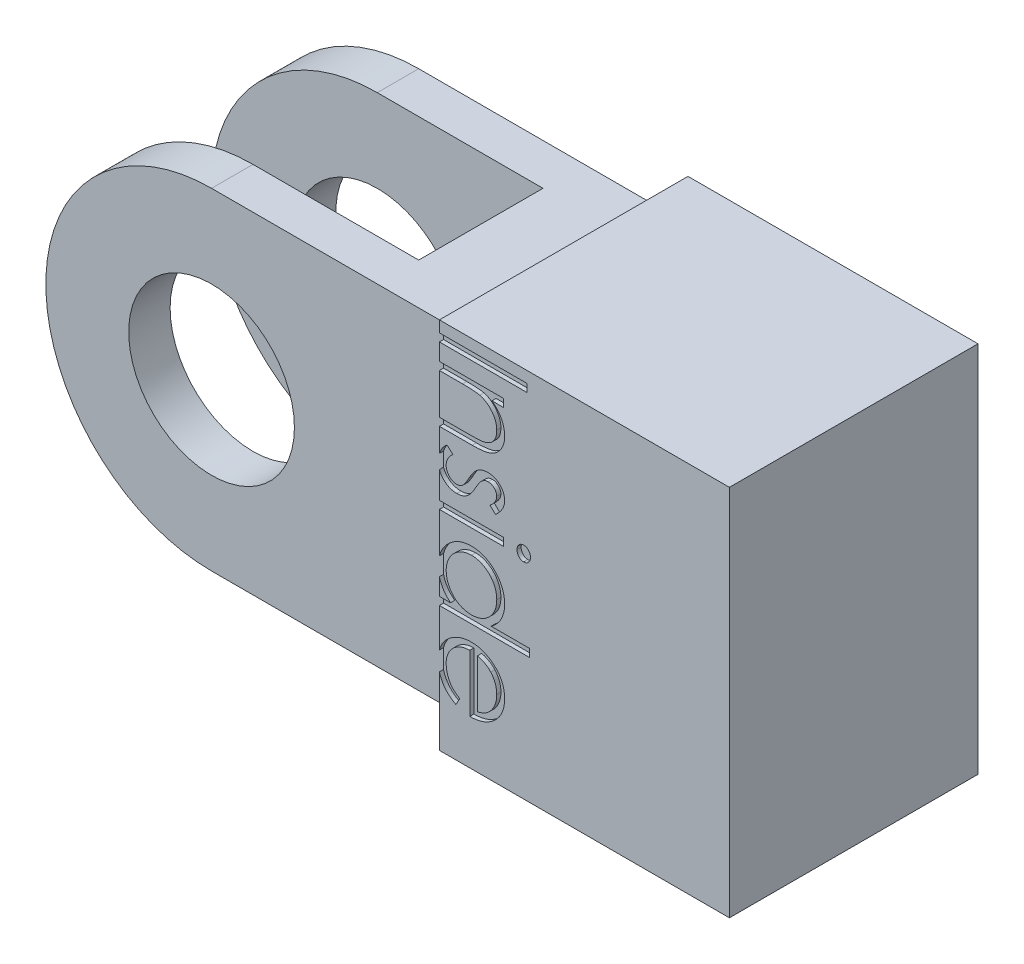
from build123d import *

# Parameters (mm, degrees)
BOSS_EXTRUDE1_DEPTH = 25
SKETCH2_R           = 20
CUT_EXTRUDE1_DEPTH  = 138.477270849
SKETCH3_W           = 80
SKETCH3_H           = 80
CUT_EXTRUDE2_DEPTH  = 15
SKETCH4_W           = 60
SKETCH4_H           = 90
BOSS_EXTRUDE2_DEPTH = 70
SKETCH5_W           = 21.166666667
SKETCH5_H           = 1.899572649
SKETCH5_W_2         = 15.467948718
SKETCH5_H_2         = 1.89957265
CUT_EXTRUDE3_DEPTH  = 1
SKETCH6_W           = 15.467948718
SKETCH6_H           = 1.89957265
CUT_EXTRUDE4_DEPTH  = 1


with BuildPart() as part:
    # Sketch1 → Boss-Extrude1 (new, symmetric)
    with BuildSketch(Plane.XY):
        with BuildLine():
            Line((-60, 0), (0, 0))
            Line((0, 0), (0, 80))
            Line((0, 80), (-60, 80))
            ThreePointArc((-60, 80), (-88.284271217, 68.284271278), (-100, 40.000000086))
            ThreePointArc((-100, 40.000000086), (-88.284271278, 11.715728783), (-60, 0))
        make_face()
    extrude(amount=BOSS_EXTRUDE1_DEPTH, both=True)

    # Sketch2 → Cut-Extrude1 (cut, through all)
    with BuildSketch(Plane.XY.offset(25)):
        with Locations((-60, 40)):
            Circle(SKETCH2_R)
    extrude(amount=-CUT_EXTRUDE1_DEPTH, mode=Mode.SUBTRACT)

    # Sketch3 → Cut-Extrude2 (cut, symmetric)
    with BuildSketch(Plane.XY):
        with Locations((-60, 40)):
            Rectangle(SKETCH3_W, SKETCH3_H)
    extrude(amount=CUT_EXTRUDE2_DEPTH, both=True, mode=Mode.SUBTRACT)

    # Sketch4 → Boss-Extrude2 (add)
    with BuildSketch(Plane(origin=(0, 0, 0), x_dir=(0, 0, -1), z_dir=(1, 0, 0))):
        with Locations((0, 40)):
            Rectangle(SKETCH4_W, SKETCH4_H)
    extrude(amount=BOSS_EXTRUDE2_DEPTH)

    # Sketch5 → Cut-Extrude3 (cut)
    # profile 1 of 7: a face of its own
    with BuildSketch(Plane.XY.offset(30)):
        with Locations((10.583333334, 81.336538461)):
            Rectangle(SKETCH5_W, SKETCH5_H)
    # profile 2 of 7: a face of its own
    with BuildSketch(Plane.XY.offset(30)):
        with BuildLine():
            Line((15.467948718, 76.316239316), (15.467948718, 74.416666667))
            Line((15.467948718, 74.416666667), (12.677951389, 74.416666667))
            add(Edge.make_bspline(
                [(12.677951389, 74.416666667), (12.931000237, 74.213843826), (13.422050354, 73.820259026), (14.067455733, 73.164791868), (14.599314951, 72.472073995), (15.023275991, 71.746347593), (15.342872254, 70.986627484), (15.573685266, 70.197544613), (15.712083991, 69.374374724), (15.730167764, 68.814580272), (15.739316239, 68.531383547)],
                knots=[0, 0, 0, 0, 1.12780773, 2.188550248, 3.19190651, 4.159438251, 5.104880172, 6.052711206, 7.014878035, 8, 8, 8, 8], degree=3))
            add(Edge.make_bspline(
                [(15.739316239, 68.531383547), (15.72874626, 68.245153637), (15.708058261, 67.68493266), (15.544892942, 66.869132505), (15.264578994, 66.106523799), (14.884479629, 65.398777141), (14.409256356, 64.762156372), (13.852647683, 64.208123481), (13.217320338, 63.74597719), (12.626105979, 63.436582915), (12.101877047, 63.232590322), (11.652853519, 63.104192901), (11.152607934, 62.995146052), (10.602639244, 62.900611913), (9.999098019, 62.836645352), (9.344457151, 62.786194416), (8.638929047, 62.750037531), (8.15096706, 62.748602997), (7.899338942, 62.747863248)],
                knots=[0, 0, 0, 0, 1.235764744, 2.418689688, 3.575570385, 4.733739044, 5.876600945, 6.994686206, 8.113221397, 9.257403329, 9.866223892, 10.540462211, 11.272173464, 12.077110251, 12.949508505, 13.892531187, 14.913238277, 16, 16, 16, 16], degree=3))
            Line((7.899338942, 62.747863248), (0, 62.747863248))
            Line((0, 62.747863248), (0, 64.647435897))
            Line((0, 64.647435897), (7.276041667, 64.647435897))
            add(Edge.make_bspline(
                [(7.276041667, 64.647435897), (7.486634548, 64.648604346), (7.889462889, 64.650839389), (8.46621841, 64.657888776), (8.989256289, 64.674881416), (9.457326083, 64.698759308), (9.869978332, 64.733708684), (10.228053482, 64.770131264), (10.531096905, 64.814671838), (10.713523832, 64.854361836), (10.795339209, 64.872162126)],
                knots=[0, 0, 0, 0, 1.430800155, 2.736877192, 3.918605307, 4.986035426, 5.920637409, 6.731861385, 7.431261377, 8, 8, 8, 8], degree=3))
            add(Edge.make_bspline(
                [(10.795339209, 64.872162126), (11.035497328, 64.936421293), (11.497727403, 65.060100307), (12.124710392, 65.365710586), (12.658099433, 65.751634441), (13.094596749, 66.222730959), (13.434296571, 66.774449655), (13.669996202, 67.405259518), (13.817414592, 68.109073202), (13.832092962, 68.604097326), (13.83974359, 68.862112714)],
                knots=[0, 0, 0, 0, 1.084156227, 2.086665306, 3.027808233, 3.945421172, 4.874247719, 5.839848303, 6.874090471, 8, 8, 8, 8], degree=3))
            add(Edge.make_bspline(
                [(13.83974359, 68.862112714), (13.836865967, 69.014922573), (13.831171225, 69.317329338), (13.773997745, 69.765752318), (13.680569417, 70.200751532), (13.55414807, 70.626518414), (13.382115263, 71.03402132), (13.182984952, 71.435168557), (12.9391429, 71.818480017), (12.665914546, 72.191205457), (12.361408734, 72.537560613), (12.044802516, 72.864452302), (11.702766682, 73.151661947), (11.347413018, 73.412369417), (10.971598324, 73.637144777), (10.579341125, 73.833426001), (10.170020613, 73.999946763), (9.885933963, 74.082695096), (9.743790064, 74.124098558)],
                knots=[0, 0, 0, 0, 1.02388931, 2.02625049, 3.024079426, 4.004119353, 4.998163158, 5.985366248, 7.002659681, 8.039138713, 9.080111048, 10.09169763, 11.086418407, 12.069932368, 13.043171485, 14.017654831, 15.008125612, 16, 16, 16, 16], degree=3))
            add(Edge.make_bspline(
                [(9.743790064, 74.124098558), (9.639437169, 74.147924051), (9.412266377, 74.199790905), (9.039464412, 74.255811088), (8.608208849, 74.306656901), (8.119002931, 74.349213746), (7.570133877, 74.375251265), (6.963945715, 74.403641188), (6.298021285, 74.413976938), (5.834400572, 74.415744984), (5.592715011, 74.416666667)],
                knots=[0, 0, 0, 0, 0.615963638, 1.340920617, 2.168419149, 3.115676021, 4.16674242, 5.331190069, 6.6087489, 8, 8, 8, 8], degree=3))
            Line((5.592715011, 74.416666667), (0, 74.416666667))
            Line((0, 74.416666667), (0, 76.316239316))
            Line((0, 76.316239316), (15.467948718, 76.316239316))
        make_face()
    # profile 3 of 7: a face of its own
    with BuildSketch(Plane.XY.offset(30)):
        with BuildLine():
            Line((13.538695246, 51.079059829), (12.211538462, 52.368055556))
            add(Edge.make_bspline(
                [(12.211538462, 52.368055556), (12.340460118, 52.479256068), (12.589005894, 52.693637566), (12.92087254, 53.033947594), (13.201893496, 53.372830526), (13.433125657, 53.708498999), (13.6151075, 54.041579423), (13.743639361, 54.37491567), (13.824331199, 54.707593019), (13.834667828, 54.9300788), (13.83974359, 55.039329594)],
                knots=[0, 0, 0, 0, 1.265880991, 2.440469525, 3.530740057, 4.536711111, 5.468008477, 6.34654737, 7.188078389, 8, 8, 8, 8], degree=3))
            add(Edge.make_bspline(
                [(13.83974359, 55.039329594), (13.83317976, 55.173182785), (13.820263073, 55.436586922), (13.69389018, 55.813479712), (13.495253203, 56.160914534), (13.219136492, 56.464238053), (12.898404106, 56.719798533), (12.54415122, 56.913499027), (12.159012115, 57.026926138), (11.892843714, 57.041668253), (11.757845887, 57.049145299)],
                knots=[0, 0, 0, 0, 1.000196853, 1.968245854, 2.94569445, 3.981000421, 5.021494845, 6.007172807, 6.989258906, 8, 8, 8, 8], degree=3))
            add(Edge.make_bspline(
                [(11.757845887, 57.049145299), (11.635611144, 57.04242753), (11.391486235, 57.029010928), (11.031362412, 56.924709582), (10.680255562, 56.758605241), (10.465184652, 56.603361685), (10.354366987, 56.523370726)],
                knots=[0, 0, 0, 0, 0.960159726, 1.917612774, 2.927026955, 4, 4, 4, 4], degree=3))
            add(Edge.make_bspline(
                [(10.354366987, 56.523370726), (10.295193549, 56.47521055), (10.169250342, 56.372707684), (9.994450848, 56.180341903), (9.801276283, 55.962491528), (9.608134459, 55.700509048), (9.404742597, 55.405681403), (9.19911065, 55.071615256), (8.97556389, 54.708912297), (8.833780875, 54.449243824), (8.760082799, 54.314269498)],
                knots=[0, 0, 0, 0, 0.66740084, 1.420478572, 2.27185888, 3.217733974, 4.268547843, 5.408967954, 6.65319498, 8, 8, 8, 8], degree=3))
            add(Edge.make_bspline(
                [(8.760082799, 54.314269498), (8.667887435, 54.149692151), (8.489796348, 53.831782908), (8.213361475, 53.380069506), (7.938609528, 52.970119306), (7.668478871, 52.59845884), (7.395411529, 52.272239329), (7.129874142, 51.981563225), (6.863843563, 51.733680731), (6.677981399, 51.594864126), (6.589142628, 51.528512286)],
                knots=[0, 0, 0, 0, 1.27191281, 2.456916733, 3.569705269, 4.599008579, 5.553216877, 6.436649441, 7.252746552, 8, 8, 8, 8], degree=3))
            add(Edge.make_bspline(
                [(6.589142628, 51.528512286), (6.409928675, 51.417829942), (6.053697995, 51.19782226), (5.463128562, 50.97579888), (4.841903508, 50.833889433), (4.414759213, 50.816518779), (4.197716346, 50.807692308)],
                knots=[0, 0, 0, 0, 0.995606783, 1.979007074, 2.973082153, 4, 4, 4, 4], degree=3))
            add(Edge.make_bspline(
                [(4.197716346, 50.807692308), (4.044893232, 50.812033789), (3.743738591, 50.820589152), (3.30030843, 50.880350286), (2.875900509, 50.982360717), (2.468031403, 51.123752557), (2.077496112, 51.305066026), (1.707236511, 51.532947658), (1.354107902, 51.797165686), (1.020095261, 52.096171214), (0.717054764, 52.428263376), (0.453413375, 52.785364022), (0.230751892, 53.162095274), (0.047958593, 53.558549027), (-0.097662435, 53.975567911), (-0.198413109, 54.413496728), (-0.25872946, 54.870867106), (-0.267101569, 55.18189548), (-0.271367521, 55.340377938)],
                knots=[0, 0, 0, 0, 1.032633728, 2.034917567, 3.017159222, 3.977707287, 4.947659047, 5.920662675, 6.910168127, 7.92466491, 8.94557085, 9.942744688, 10.919024275, 11.897637117, 12.88838639, 13.898512555, 14.929200919, 16, 16, 16, 16], degree=3))
            add(Edge.make_bspline(
                [(-0.271367521, 55.340377938), (-0.265364048, 55.554265142), (-0.253440519, 55.979067605), (-0.141522911, 56.607353049), (0.032620662, 57.221311923), (0.272807502, 57.816298095), (0.576099908, 58.379005546), (0.939334384, 58.893844947), (1.350511987, 59.362604744), (1.665671019, 59.629415257), (1.823250534, 59.762820513)],
                knots=[0, 0, 0, 0, 1.013940152, 2.01379169, 3.017749504, 4.037548394, 5.051665909, 6.043208538, 7.021604269, 8, 8, 8, 8], degree=3))
            Line((1.823250534, 59.762820513), (3.256410256, 58.503505609))
            add(Edge.make_bspline(
                [(3.256410256, 58.503505609), (3.127264776, 58.383929588), (2.876896734, 58.15211339), (2.543525721, 57.781386984), (2.264118034, 57.404140129), (2.030417383, 57.024139882), (1.850347087, 56.635761216), (1.723839401, 56.241180597), (1.642534048, 55.841200604), (1.632989197, 55.572552449), (1.628205128, 55.437900641)],
                knots=[0, 0, 0, 0, 1.179806542, 2.287233372, 3.337373186, 4.324005949, 5.273901747, 6.200048787, 7.097828587, 8, 8, 8, 8], degree=3))
            add(Edge.make_bspline(
                [(1.628205128, 55.437900641), (1.636495355, 55.254549375), (1.652693067, 54.896311756), (1.799753576, 54.383209026), (2.030348999, 53.909446856), (2.357432649, 53.498067576), (2.738163969, 53.147897364), (3.167025548, 52.894331738), (3.631431024, 52.735423439), (3.953359711, 52.716760494), (4.117154113, 52.707264957)],
                knots=[0, 0, 0, 0, 1.072336372, 2.095165389, 3.102688358, 4.141489647, 5.156069229, 6.117746104, 7.042326257, 8, 8, 8, 8], degree=3))
            add(Edge.make_bspline(
                [(4.117154113, 52.707264957), (4.252074188, 52.713834452), (4.518455815, 52.726805039), (4.903993592, 52.828666731), (5.269688765, 52.989611124), (5.48371187, 53.148086854), (5.592715011, 53.228799412)],
                knots=[0, 0, 0, 0, 1.013901739, 2.00181326, 2.98231254, 4, 4, 4, 4], degree=3))
            add(Edge.make_bspline(
                [(5.592715011, 53.228799412), (5.647357439, 53.277315798), (5.766388383, 53.383002007), (5.938292431, 53.576859895), (6.123579983, 53.808978776), (6.319109116, 54.081969285), (6.522300681, 54.396381745), (6.732088669, 54.753490478), (6.958437296, 55.148403343), (7.108537117, 55.427625732), (7.186999199, 55.573584402)],
                knots=[0, 0, 0, 0, 0.615000592, 1.339693406, 2.178160186, 3.116406724, 4.166410947, 5.330106347, 6.604359322, 8, 8, 8, 8], degree=3))
            add(Edge.make_bspline(
                [(7.186999199, 55.573584402), (7.274926328, 55.731104558), (7.445445093, 56.036586412), (7.711032817, 56.469277172), (7.981163478, 56.85963498), (8.240683982, 57.217052741), (8.50327731, 57.532502632), (8.769234973, 57.804741939), (9.02783108, 58.044489006), (9.211057588, 58.177218591), (9.298577724, 58.240618323)],
                knots=[0, 0, 0, 0, 1.262093308, 2.447601706, 3.550203992, 4.582594899, 5.537233252, 6.418365656, 7.244515135, 8, 8, 8, 8], degree=3))
            add(Edge.make_bspline(
                [(9.298577724, 58.240618323), (9.474839301, 58.350265282), (9.82742405, 58.569597519), (10.415920743, 58.78256558), (11.035469423, 58.928954421), (11.46295659, 58.942031733), (11.681523771, 58.948717949)],
                knots=[0, 0, 0, 0, 0.985009483, 1.970363186, 2.962279964, 4, 4, 4, 4], degree=3))
            add(Edge.make_bspline(
                [(11.681523771, 58.948717949), (11.824400852, 58.945486871), (12.104031542, 58.939163195), (12.514904232, 58.888708135), (12.905250143, 58.796810421), (13.28103036, 58.681660563), (13.634606909, 58.521182862), (13.972746631, 58.33058658), (14.289127804, 58.100586031), (14.585331363, 57.842062316), (14.857179179, 57.56101763), (15.090280605, 57.253207239), (15.29073508, 56.929647233), (15.458584311, 56.588452278), (15.585610025, 56.226696688), (15.673038029, 55.846814869), (15.731430319, 55.449601454), (15.736649743, 55.178056384), (15.739316239, 55.039329594)],
                knots=[0, 0, 0, 0, 1.087761869, 2.12890409, 3.144425528, 4.138218063, 5.116152125, 6.094559764, 7.089109474, 8.088306095, 9.085414286, 10.060442677, 11.0220762, 11.979848209, 12.949875201, 13.933947973, 14.944496518, 16, 16, 16, 16], degree=3))
            add(Edge.make_bspline(
                [(15.739316239, 55.039329594), (15.732653242, 54.874874283), (15.719202256, 54.54287865), (15.611881111, 54.044955127), (15.437106149, 53.548329127), (15.190050988, 53.05249165), (14.879313187, 52.555330212), (14.496837303, 52.059073277), (14.053419618, 51.555658208), (13.714103643, 51.241475604), (13.538695246, 51.079059829)],
                knots=[0, 0, 0, 0, 0.845753203, 1.707371858, 2.609134499, 3.549244224, 4.552329203, 5.621587647, 6.770486714, 8, 8, 8, 8], degree=3))
        make_face()
    # profile 4 of 7: a face of its own
    with BuildSketch(Plane.XY.offset(30)):
        with BuildLine():
            add(Edge.make_bspline(
                [(21.980769231, 46.33860844), (21.975277543, 46.220752069), (21.964523764, 45.989966659), (21.873169824, 45.655899246), (21.71595729, 45.352013667), (21.511891589, 45.078452093), (21.262033491, 44.851682121), (20.978139463, 44.689075983), (20.669076615, 44.58526872), (20.453728209, 44.572659356), (20.344083868, 44.566239316)],
                knots=[0, 0, 0, 0, 1.054986045, 2.065865298, 3.074122704, 4.105114675, 5.109626121, 6.074217918, 7.019490725, 8, 8, 8, 8], degree=3))
            add(Edge.make_bspline(
                [(20.344083868, 44.566239316), (20.237285551, 44.572802977), (20.026157919, 44.585778558), (19.722453831, 44.688999245), (19.442512965, 44.853045382), (19.193143358, 45.078301156), (18.989195545, 45.352053531), (18.831951865, 45.6558887), (18.740606155, 45.989969433), (18.729851242, 46.220753007), (18.724358974, 46.33860844)],
                knots=[0, 0, 0, 0, 0.961106377, 1.899993565, 2.859409042, 3.870007927, 4.90724781, 5.921615355, 6.938620636, 8, 8, 8, 8], degree=3))
            add(Edge.make_bspline(
                [(18.724358974, 46.33860844), (18.729674849, 46.455110277), (18.740021504, 46.681865881), (18.833044737, 47.009790776), (18.988853606, 47.308786728), (19.195965722, 47.577874547), (19.440854822, 47.807596338), (19.722665289, 47.971037191), (20.026104082, 48.074533858), (20.237267466, 48.087472247), (20.344083868, 48.094017094)],
                knots=[0, 0, 0, 0, 1.055304112, 2.054011575, 3.063363921, 4.096942562, 5.122536081, 6.088009498, 7.032825006, 8, 8, 8, 8], degree=3))
            add(Edge.make_bspline(
                [(20.344083868, 48.094017094), (20.453746981, 48.087616567), (20.669132256, 48.075045528), (20.977924388, 47.970956862), (21.26370578, 47.808976415), (21.509071271, 47.577726115), (21.716298478, 47.308825586), (21.87207725, 47.009780657), (21.965108351, 46.681868567), (21.975453916, 46.455111189), (21.980769231, 46.33860844)],
                knots=[0, 0, 0, 0, 0.986662878, 1.937868148, 2.908513651, 3.927890639, 4.955204348, 5.958438607, 6.951092507, 8, 8, 8, 8], degree=3))
        make_face()
    # profile 5 of 7: a face of its own
    with BuildSketch(Plane.XY.offset(30)):
        with Locations((7.733974359, 46.330128205)):
            Rectangle(SKETCH5_W_2, SKETCH5_H_2)
    # profile 6 of 7: a face of its own
    with BuildSketch(Plane.XY.offset(30)):
        with BuildLine():
            Line((21.709401709, 25.299145299), (0, 25.299145299))
            Line((0, 25.299145299), (0, 27.198717949))
            Line((0, 27.198717949), (2.675514156, 27.198717949))
            add(Edge.make_bspline(
                [(2.675514156, 27.198717949), (2.433304588, 27.412872511), (1.96062957, 27.830797833), (1.344959191, 28.528692985), (0.831872211, 29.26538441), (0.42131859, 30.043363262), (0.110577536, 30.860301849), (-0.107944581, 31.71387047), (-0.250196512, 32.602931526), (-0.264247206, 33.209240509), (-0.271367521, 33.516493056)],
                knots=[0, 0, 0, 0, 1.074295371, 2.096500925, 3.086030275, 4.053105238, 5.014108356, 5.985331429, 6.979048527, 8, 8, 8, 8], degree=3))
            add(Edge.make_bspline(
                [(-0.271367521, 33.516493056), (-0.26395212, 33.789652376), (-0.24932862, 34.32833465), (-0.135843657, 35.120737919), (0.046309517, 35.883335221), (0.299950649, 36.616612575), (0.634660847, 37.315601426), (1.039706419, 37.98424039), (1.517326697, 38.624089951), (2.065474638, 39.222981511), (2.660211556, 39.77517437), (3.296399546, 40.258287349), (3.965300582, 40.667741329), (4.666726662, 41.004239167), (5.400165046, 41.264638839), (6.16511258, 41.445806552), (6.960296432, 41.559169221), (7.501799667, 41.573785312), (7.776375534, 41.581196581)],
                knots=[0, 0, 0, 0, 1.034036272, 2.039165313, 3.024406509, 3.999331371, 4.971254918, 5.953351348, 6.95522652, 7.989525907, 9.023492927, 10.024309745, 11.009187477, 11.988246066, 12.964946762, 13.950187958, 14.960617622, 16, 16, 16, 16], degree=3))
            add(Edge.make_bspline(
                [(7.776375534, 41.581196581), (8.045276221, 41.573620933), (8.576878373, 41.558644286), (9.358690126, 41.447019569), (10.11179028, 41.259454322), (10.833389072, 40.995728729), (11.52639262, 40.659051953), (12.185378851, 40.24255629), (12.8204284, 39.759617402), (13.411176353, 39.201522998), (13.954877102, 38.597256167), (14.433658091, 37.95382671), (14.837665161, 37.27925755), (15.166083633, 36.572196078), (15.427064943, 35.837648915), (15.608994045, 35.070036101), (15.715939234, 34.272848426), (15.731449031, 33.731649709), (15.739316239, 33.45713141)],
                knots=[0, 0, 0, 0, 1.02050356, 2.017480486, 2.990790918, 3.96161403, 4.928589988, 5.909588639, 6.91611943, 7.952353252, 8.989586576, 9.99823133, 10.991940466, 11.968822692, 12.952985106, 13.945868367, 14.958059758, 16, 16, 16, 16], degree=3))
            add(Edge.make_bspline(
                [(15.739316239, 33.45713141), (15.729883929, 33.141329964), (15.711369352, 32.521446822), (15.555039459, 31.613779775), (15.295715411, 30.754329626), (14.937078659, 29.94006638), (14.474288059, 29.175830144), (13.910447675, 28.458482376), (13.238929586, 27.793390841), (12.733145644, 27.399964432), (12.474425748, 27.198717949)],
                knots=[0, 0, 0, 0, 1.030970925, 2.023681352, 2.997808474, 3.956843046, 4.921958419, 5.908293655, 6.930045022, 8, 8, 8, 8], degree=3))
            Line((12.474425748, 27.198717949), (21.709401709, 27.198717949))
            Line((21.709401709, 27.198717949), (21.709401709, 25.299145299))
        make_face()
        with BuildLine():
            add(Edge.make_bspline(
                [(13.83974359, 33.431690705), (13.829864077, 33.709363297), (13.810363491, 34.257444826), (13.658122245, 35.06204185), (13.404825952, 35.831993961), (13.058385102, 36.563395581), (12.622863338, 37.244896716), (12.095688317, 37.853385142), (11.493624382, 38.39614079), (10.811609692, 38.844881801), (10.088794938, 39.223215115), (9.327472416, 39.482657837), (8.548763432, 39.655299446), (8.020393214, 39.672826256), (7.755174947, 39.681623932)],
                knots=[0, 0, 0, 0, 1.031093775, 2.03521511, 3.029845951, 4.035119871, 5.034286494, 6.024708811, 7.017619509, 8.03559408, 9.050082311, 10.039808432, 11.016071318, 12, 12, 12, 12], degree=3))
            add(Edge.make_bspline(
                [(7.755174947, 39.681623932), (7.49159388, 39.670241802), (6.965464896, 39.647522158), (6.18444226, 39.487208546), (5.426184619, 39.209439404), (4.693357298, 38.839741587), (4.009942689, 38.380934968), (3.396105462, 37.842683837), (2.866816245, 37.226436072), (2.423801006, 36.543456705), (2.067194801, 35.815110643), (1.815736301, 35.048806907), (1.656953797, 34.258009691), (1.637820252, 33.719344839), (1.628205128, 33.448651175)],
                knots=[0, 0, 0, 0, 0.979154363, 1.954470772, 2.947816011, 3.971783346, 4.997163654, 5.998045606, 6.995988793, 8.00538986, 9.015323546, 10.000094788, 10.994993517, 12, 12, 12, 12], degree=3))
            add(Edge.make_bspline(
                [(1.628205128, 33.448651175), (1.638093615, 33.173775382), (1.657710814, 32.628465111), (1.812498121, 31.821974348), (2.06264501, 31.038112608), (2.414044397, 30.288540084), (2.84755241, 29.590775167), (3.35729958, 28.965317657), (3.945165004, 28.43124757), (4.596429063, 27.983528705), (5.307054088, 27.629853243), (6.066875716, 27.380401363), (6.869922844, 27.227191304), (7.419517151, 27.208340301), (7.700053419, 27.198717949)],
                knots=[0, 0, 0, 0, 1.017484689, 2.018529338, 3.030031036, 4.058138743, 5.076350332, 6.065651025, 7.036469986, 8.00785331, 8.984076697, 9.96571663, 10.961615403, 12, 12, 12, 12], degree=3))
            add(Edge.make_bspline(
                [(7.700053419, 27.198717949), (7.913763073, 27.204521677), (8.334411303, 27.21594525), (8.952040802, 27.303214526), (9.543092831, 27.442041974), (10.108214318, 27.637641827), (10.644186748, 27.894677854), (11.155211402, 28.204360128), (11.636528152, 28.573040692), (12.087527457, 28.989499657), (12.496826346, 29.450491698), (12.857578953, 29.940696988), (13.162874925, 30.458882175), (13.407191557, 31.004683522), (13.606230192, 31.573897228), (13.73769177, 32.171979101), (13.828248508, 32.792901568), (13.835871552, 33.216519065), (13.83974359, 33.431690705)],
                knots=[0, 0, 0, 0, 1.050062701, 2.066855696, 3.059271411, 4.030305351, 4.999747758, 5.975466543, 6.961907836, 7.974539719, 8.98812422, 9.98710676, 10.961662635, 11.93785114, 12.922015094, 13.919620009, 14.94329489, 16, 16, 16, 16], degree=3))
        make_face(mode=Mode.SUBTRACT)
    # profile 7 of 7: a face of its own
    with BuildSketch(Plane.XY.offset(30)):
        with BuildLine():
            Line((4.884615385, 8.262353098), (3.998430823, 6.574786325))
            add(Edge.make_bspline(
                [(3.998430823, 6.574786325), (3.759912093, 6.709284127), (3.2958491, 6.970963589), (2.657968638, 7.420644521), (2.086099068, 7.892606499), (1.589093236, 8.40312727), (1.158183591, 8.945919037), (0.7836561, 9.521779143), (0.460983615, 10.128783319), (0.190575003, 10.769071315), (-0.017586153, 11.448175007), (-0.164550326, 12.167983409), (-0.255410521, 12.929807767), (-0.265963739, 13.451997026), (-0.271367521, 13.719384348)],
                knots=[0, 0, 0, 0, 1.120373846, 2.179803828, 3.190307243, 4.151866639, 5.090753574, 6.023181945, 6.960194942, 7.901556876, 8.864247182, 9.862852693, 10.905672442, 12, 12, 12, 12], degree=3))
            add(Edge.make_bspline(
                [(-0.271367521, 13.719384348), (-0.264429841, 14.016576306), (-0.250896438, 14.596311719), (-0.13422297, 15.44019497), (0.056109893, 16.234727578), (0.321996644, 16.979865257), (0.669295566, 17.673781839), (1.092382588, 18.317861595), (1.589091996, 18.91547248), (2.163696946, 19.447854781), (2.7786986, 19.926923088), (3.419233956, 20.350416879), (4.08562876, 20.701997583), (4.767519318, 20.99766046), (5.471181, 21.221673554), (6.192757248, 21.385651544), (6.935823551, 21.478374193), (7.438336957, 21.492753635), (7.691573184, 21.5)],
                knots=[0, 0, 0, 0, 1.145226127, 2.234004399, 3.276654467, 4.290038057, 5.276870678, 6.260645262, 7.254731018, 8.264593254, 9.273837991, 10.257612574, 11.220387342, 12.174754112, 13.118989047, 14.062768009, 15.023752772, 16, 16, 16, 16], degree=3))
            add(Edge.make_bspline(
                [(7.691573184, 21.5), (7.929213349, 21.493594717), (8.400184773, 21.480900291), (9.097266876, 21.400885529), (9.774772279, 21.259079185), (10.433263941, 21.064489036), (11.071639322, 20.813202928), (11.690286945, 20.505789031), (12.288548505, 20.14176846), (12.665938885, 19.860719433), (12.856036325, 19.719150641)],
                knots=[0, 0, 0, 0, 1.024358464, 2.0301432, 3.019427413, 4.004406732, 4.986367066, 5.972626655, 6.978780325, 8, 8, 8, 8], degree=3))
            add(Edge.make_bspline(
                [(12.856036325, 19.719150641), (13.085052825, 19.527394655), (13.535831163, 19.149957025), (14.128124848, 18.5115924), (14.624294345, 17.820348355), (15.035575597, 17.084887569), (15.348078129, 16.296662226), (15.580957317, 15.466267942), (15.711452907, 14.584249397), (15.729885044, 13.981270204), (15.739316239, 13.672743056)],
                knots=[0, 0, 0, 0, 1.030682036, 2.02871468, 2.997146059, 3.962720338, 4.930598197, 5.918074684, 6.934738563, 8, 8, 8, 8], degree=3))
            add(Edge.make_bspline(
                [(15.739316239, 13.672743056), (15.731127467, 13.355559919), (15.715062964, 12.733318908), (15.566132281, 11.825981795), (15.329957308, 10.967457461), (14.996408194, 10.158089459), (14.566062333, 9.39779573), (14.033014054, 8.691518192), (13.413628478, 8.027178092), (12.937298593, 7.640683353), (12.694911859, 7.444010417)],
                knots=[0, 0, 0, 0, 1.056321875, 2.072262726, 3.055038591, 4.01806755, 4.982017516, 5.957941055, 6.960871419, 8, 8, 8, 8], degree=3))
            add(Edge.make_bspline(
                [(12.694911859, 7.444010417), (12.512252105, 7.310195123), (12.148148435, 7.043455251), (11.554446675, 6.709341836), (10.933292128, 6.419313781), (10.274644141, 6.187490635), (9.58630668, 5.999775557), (8.86335891, 5.863965272), (8.106016112, 5.784320436), (7.58999361, 5.76866498), (7.326923077, 5.760683761)],
                knots=[0, 0, 0, 0, 0.94817472, 1.890038105, 2.849395472, 3.817997239, 4.812318967, 5.836947057, 6.897266129, 8, 8, 8, 8], degree=3))
            Line((7.326923077, 5.760683761), (7.326923077, 19.60042735))
            add(Edge.make_bspline(
                [(7.326923077, 19.60042735), (7.12311963, 19.591107555), (6.72234837, 19.572780554), (6.135847425, 19.487543221), (5.577420956, 19.352535702), (5.049448283, 19.164871332), (4.550195895, 18.929559574), (4.076223003, 18.650368862), (3.634727785, 18.315251482), (3.21998902, 17.942085605), (2.850785244, 17.526514373), (2.520074573, 17.089473468), (2.244426284, 16.625226634), (2.017313301, 16.138453885), (1.842511933, 15.626630786), (1.722137772, 15.090477091), (1.641721774, 14.531660674), (1.632764993, 14.15075079), (1.628205128, 13.956830929)],
                knots=[0, 0, 0, 0, 1.094405546, 2.152104367, 3.174987145, 4.173015398, 5.153654967, 6.133208507, 7.119289451, 8.123438607, 9.122504012, 10.097966803, 11.060604936, 12.014205423, 12.976096155, 13.956823727, 14.959826266, 16, 16, 16, 16], degree=3))
            add(Edge.make_bspline(
                [(1.628205128, 13.956830929), (1.631856849, 13.767226303), (1.639102565, 13.391014353), (1.710604541, 12.829453468), (1.824327601, 12.276676125), (1.980635028, 11.736652632), (2.173186569, 11.221124492), (2.403993974, 10.742327162), (2.65639149, 10.298647626), (2.949604461, 9.886364732), (3.304784691, 9.486465978), (3.753095326, 9.09476257), (4.277864897, 8.669085908), (4.674436343, 8.403245794), (4.884615385, 8.262353098)],
                knots=[0, 0, 0, 0, 0.990963276, 1.966261236, 2.95471375, 3.93937425, 4.902926125, 5.828461241, 6.715766441, 7.568835615, 8.469155523, 9.505141836, 10.677749234, 12, 12, 12, 12], degree=3))
        make_face()
        with BuildLine():
            add(Edge.make_bspline(
                [(9.226495726, 7.66025641), (9.478517807, 7.729665046), (9.963579185, 7.863254327), (10.633687221, 8.14418895), (11.232691923, 8.453385833), (11.750702863, 8.826590029), (12.207561915, 9.253089774), (12.610846408, 9.740518543), (12.969900332, 10.287729063), (13.273283236, 10.890952231), (13.531433206, 11.529856204), (13.704552897, 12.198754243), (13.82314239, 12.881276746), (13.834186206, 13.342917216), (13.83974359, 13.575220353)],
                knots=[0, 0, 0, 0, 1.154756201, 2.222533969, 3.206705588, 4.129403772, 5.035894089, 5.963342549, 6.920206228, 7.923656548, 8.944970878, 9.96070521, 10.973801891, 12, 12, 12, 12], degree=3))
            add(Edge.make_bspline(
                [(13.83974359, 13.575220353), (13.83602882, 13.764804565), (13.828685502, 14.139572695), (13.759544111, 14.691802612), (13.643768004, 15.223098342), (13.48958432, 15.736385237), (13.277150445, 16.222728983), (13.033114772, 16.694785926), (12.733293106, 17.140895718), (12.504970936, 17.419952393), (12.389623397, 17.560930823)],
                knots=[0, 0, 0, 0, 1.048700258, 2.073059931, 3.073189922, 4.055269162, 5.032885305, 6.005420607, 6.992345662, 8, 8, 8, 8], degree=3))
            add(Edge.make_bspline(
                [(12.389623397, 17.560930823), (12.298338727, 17.661885433), (12.113600801, 17.866192959), (11.795319409, 18.139185636), (11.452107581, 18.40056659), (11.070834684, 18.638441538), (10.655842354, 18.856625037), (10.210630941, 19.060792518), (9.731822011, 19.244557962), (9.398160116, 19.347948723), (9.226495726, 19.401141827)],
                knots=[0, 0, 0, 0, 0.879870761, 1.780643979, 2.707998968, 3.669668524, 4.684282772, 5.740141944, 6.837334558, 8, 8, 8, 8], degree=3))
            Line((9.226495726, 19.401141827), (9.226495726, 7.66025641))
        make_face(mode=Mode.SUBTRACT)
    extrude(amount=-CUT_EXTRUDE3_DEPTH, mode=Mode.SUBTRACT)

    # Sketch6 → Cut-Extrude4 (cut)
    # profile 1 of 7: a face of its own
    with BuildSketch(Plane(origin=(0, 0, -30), x_dir=(-1, 0, 0), z_dir=(0, 0, -1))):
        with BuildLine():
            add(Edge.make_bspline(
                [(-21.709401709, 7.618589744), (-21.699641785, 8.010567212), (-21.680472487, 8.780443301), (-21.528890206, 9.910873458), (-21.279401633, 10.993311021), (-20.927070495, 12.02837827), (-20.470317448, 13.012138589), (-19.915493303, 13.947370376), (-19.259226285, 14.831270836), (-18.511153048, 15.657755726), (-17.691890767, 16.411701417), (-16.814854958, 17.073292675), (-15.891072274, 17.631407336), (-14.920494534, 18.088284974), (-13.905387766, 18.4469642), (-12.840062819, 18.694409584), (-11.731497244, 18.852487914), (-10.97538192, 18.870967437), (-10.591813568, 18.88034188)],
                knots=[0, 0, 0, 0, 1.065064174, 2.09187391, 3.093564831, 4.079973196, 5.057907931, 6.036227367, 7.030399151, 8.044883615, 9.061699972, 10.052012555, 11.025713132, 11.989727027, 12.962874294, 13.945865945, 14.957962116, 16, 16, 16, 16], degree=3))
            add(Edge.make_bspline(
                [(-10.591813568, 18.88034188), (-10.21107289, 18.870964282), (-9.460588905, 18.852479949), (-8.359026446, 18.694281319), (-7.300248504, 18.445860086), (-6.28661496, 18.092725911), (-5.318008501, 17.635497685), (-4.393526484, 17.076561396), (-3.514148109, 16.416225763), (-2.689241779, 15.665481711), (-1.934643478, 14.844658725), (-1.269058384, 13.970993617), (-0.710700769, 13.047235565), (-0.248722506, 12.082957434), (0.102481898, 11.070587405), (0.3581703, 10.01749251), (0.514679357, 8.917935143), (0.533280527, 8.168906986), (0.542735043, 7.788194444)],
                knots=[0, 0, 0, 0, 1.043748596, 2.057349401, 3.045489418, 4.02252776, 4.995289225, 5.97782527, 6.980224157, 8.006516136, 9.032559198, 10.034193337, 11.013412982, 11.987833483, 12.961212594, 13.946489799, 14.956251404, 16, 16, 16, 16], degree=3))
            add(Edge.make_bspline(
                [(0.542735043, 7.788194444), (0.533364941, 7.404628325), (0.514893977, 6.6485174), (0.356558815, 5.538555329), (0.108961406, 4.472494687), (-0.244881375, 3.453384087), (-0.70218558, 2.480655227), (-1.259802539, 1.55240568), (-1.92145525, 0.672361313), (-2.672367391, -0.15218163), (-3.489833444, -0.906617257), (-4.365735844, -1.564352529), (-5.282890272, -2.122094881), (-6.243841966, -2.577863606), (-7.243945452, -2.938691527), (-8.289871959, -3.184858761), (-9.375658494, -3.344128566), (-10.114936975, -3.362482161), (-10.490050748, -3.371794872)],
                knots=[0, 0, 0, 0, 1.053102029, 2.075944431, 3.073151272, 4.055350789, 5.033113405, 6.020478099, 7.024410459, 8.052272461, 9.079885166, 10.07527673, 11.055994387, 12.023226415, 12.992069828, 13.970394897, 14.97016774, 16, 16, 16, 16], degree=3))
            add(Edge.make_bspline(
                [(-10.490050748, -3.371794872), (-10.741829271, -3.3685616), (-11.242210018, -3.362135845), (-11.985260409, -3.284776562), (-12.716361054, -3.172522465), (-13.433432977, -3.011644232), (-14.134720837, -2.801237484), (-14.825061165, -2.552970461), (-15.49745797, -2.249743777), (-16.155096577, -1.90696081), (-16.787725341, -1.524377495), (-17.385711391, -1.101795582), (-17.954072658, -0.654057877), (-18.478080729, -0.163212592), (-18.972979508, 0.354563053), (-19.431163558, 0.907668483), (-19.856764452, 1.492728722), (-20.240306515, 2.112261209), (-20.58719271, 2.7510003), (-20.884867713, 3.409445576), (-21.1403558, 4.078654365), (-21.347431266, 4.761761045), (-21.510910722, 5.456951619), (-21.622231385, 6.165743364), (-21.699787974, 6.887571609), (-21.706183343, 7.373868633), (-21.709401709, 7.618589744)],
                knots=[0, 0, 0, 0, 1.037015668, 2.060948919, 3.074880161, 4.083647147, 5.086022904, 6.090072063, 7.104153813, 8.122640571, 9.144368836, 10.147691507, 11.138137339, 12.123020368, 13.103399296, 14.087645067, 15.080126199, 16.082011238, 17.087798457, 18.072939717, 19.057185487, 20.037253025, 21.01195951, 21.997135196, 22.992090687, 24, 24, 24, 24], degree=3))
        make_face()
        with BuildLine():
            add(Edge.make_bspline(
                [(-19.538461538, 7.711872329), (-19.536021456, 7.51100031), (-19.531164619, 7.111176622), (-19.466838551, 6.516827167), (-19.375814165, 5.930113899), (-19.243614836, 5.352172186), (-19.072620747, 4.781789975), (-18.86638838, 4.218714041), (-18.617125659, 3.664874983), (-18.336799442, 3.120964705), (-18.018393704, 2.599545751), (-17.680277909, 2.099362395), (-17.309889223, 1.633424829), (-16.915237868, 1.195332375), (-16.492898878, 0.786174526), (-16.045645805, 0.406131757), (-15.571544157, 0.055515718), (-15.072545063, -0.261454078), (-14.551434547, -0.543532455), (-14.018173994, -0.796089052), (-13.466496481, -1.005448833), (-12.899844646, -1.171292973), (-12.320715596, -1.312056648), (-11.725954027, -1.400354042), (-11.117610294, -1.465313921), (-10.706479596, -1.469901725), (-10.498530983, -1.472222222)],
                knots=[0, 0, 0, 0, 1.008406545, 2.007172654, 2.999155034, 3.989332444, 4.982025741, 5.988181096, 6.998684226, 8.030553839, 9.059268815, 10.065399129, 11.060956322, 12.046057109, 13.024974577, 14.012068307, 14.991706172, 15.984221787, 16.978487447, 17.966117052, 18.945677757, 19.938371053, 20.93015022, 21.936155317, 22.956113857, 24, 24, 24, 24], degree=3))
            add(Edge.make_bspline(
                [(-10.498530983, -1.472222222), (-10.192756885, -1.464494703), (-9.591204641, -1.449292282), (-8.709555247, -1.316752942), (-7.861427933, -1.110972524), (-7.051877868, -0.812629789), (-6.277295048, -0.43203476), (-5.540693869, 0.032213909), (-4.842291619, 0.584367757), (-4.187287206, 1.211197139), (-3.589676733, 1.896618546), (-3.064373988, 2.624086366), (-2.622264546, 3.387845142), (-2.252670988, 4.18349277), (-1.974234579, 5.017822347), (-1.775709548, 5.885484476), (-1.647039832, 6.786498335), (-1.634542943, 7.400487061), (-1.628205128, 7.711872329)],
                knots=[0, 0, 0, 0, 1.032022337, 2.030307203, 3.003823408, 3.974715386, 4.937372378, 5.913284036, 6.909147208, 7.938749767, 8.970518239, 9.975863271, 10.963918693, 11.946286286, 12.933361397, 13.927862637, 14.949112547, 16, 16, 16, 16], degree=3))
            add(Edge.make_bspline(
                [(-1.628205128, 7.711872329), (-1.631078477, 7.921178234), (-1.636777192, 8.336294706), (-1.69425557, 8.953717462), (-1.786244519, 9.560074136), (-1.919343874, 10.154244388), (-2.083720248, 10.73700671), (-2.287612199, 11.306602701), (-2.532029779, 11.862843175), (-2.804425085, 12.408463291), (-3.11385881, 12.931246085), (-3.447416493, 13.428395441), (-3.811269805, 13.893530269), (-4.200620827, 14.331417176), (-4.62166155, 14.737707521), (-5.066196502, 15.11666823), (-5.541304378, 15.46122202), (-6.03825969, 15.777117282), (-6.555570995, 16.062637445), (-7.090297596, 16.307888772), (-7.639571575, 16.51733848), (-8.203796494, 16.686178672), (-8.781703182, 16.818550018), (-9.374118743, 16.909743174), (-9.979843636, 16.973537316), (-10.389532758, 16.978345477), (-10.596053686, 16.980769231)],
                knots=[0, 0, 0, 0, 1.047334373, 2.07717862, 3.100662057, 4.115010574, 5.122652213, 6.129548646, 7.140165612, 8.16200981, 9.179904151, 10.178566626, 11.156366481, 12.133321541, 13.108841334, 14.082538371, 15.054589433, 16.043660176, 17.028268541, 18.009491307, 18.985652105, 19.968123554, 20.954864208, 21.950389976, 22.966808393, 24, 24, 24, 24], degree=3))
            add(Edge.make_bspline(
                [(-10.596053686, 16.980769231), (-10.801161736, 16.978343452), (-11.208031334, 16.973531474), (-11.809532474, 16.909774603), (-12.397682848, 16.818450172), (-12.970173464, 16.686837602), (-13.527150268, 16.517200964), (-14.068090089, 16.308029943), (-14.595008348, 16.061376076), (-15.106601953, 15.778297441), (-15.597517621, 15.460098196), (-16.066820859, 15.112390423), (-16.505737749, 14.729197703), (-16.924955571, 14.321368082), (-17.3160891, 13.879096445), (-17.677627063, 13.402305611), (-18.025859154, 12.90286705), (-18.334048412, 12.369486328), (-18.620085647, 11.820992872), (-18.86411931, 11.257659322), (-19.073709666, 10.687530909), (-19.244125288, 10.108328152), (-19.375307778, 9.520324828), (-19.466920009, 8.923862884), (-19.531142526, 8.321024312), (-19.536014126, 7.915567339), (-19.538461538, 7.711872329)],
                knots=[0, 0, 0, 0, 1.029877221, 2.042951179, 3.035109885, 4.018542222, 4.991021277, 5.957494829, 6.929429462, 7.911425532, 8.892163142, 9.866273635, 10.842761649, 11.81676864, 12.802607151, 13.805177466, 14.821356543, 15.858816981, 16.897175917, 17.927346774, 18.940346092, 19.946830556, 20.957962087, 21.964146003, 22.97721996, 24, 24, 24, 24], degree=3))
        make_face(mode=Mode.SUBTRACT)
    # profile 2 of 7: a face of its own
    with BuildSketch(Plane(origin=(0, 0, -30), x_dir=(-1, 0, 0), z_dir=(0, 0, -1))):
        with BuildLine():
            Line((-15.467948718, 22.408119658), (-15.467948718, 24.307692308))
            Line((-15.467948718, 24.307692308), (-8.293669872, 24.307692308))
            add(Edge.make_bspline(
                [(-8.293669872, 24.307692308), (-8.083075151, 24.308550494), (-7.680217313, 24.310192166), (-7.10052166, 24.321325475), (-6.571858684, 24.347512232), (-6.09392299, 24.38025298), (-5.666795431, 24.422357327), (-5.291967891, 24.472451936), (-4.96518973, 24.528443343), (-4.768379912, 24.583251184), (-4.676849626, 24.608740652)],
                knots=[0, 0, 0, 0, 1.388932606, 2.656963016, 3.823490214, 4.879454478, 5.816252168, 6.653371382, 7.373723809, 8, 8, 8, 8], degree=3))
            add(Edge.make_bspline(
                [(-4.676849626, 24.608740652), (-4.561806549, 24.649631356), (-4.334112113, 24.730562656), (-4.005188129, 24.877359439), (-3.700537612, 25.058959379), (-3.408412982, 25.2576831), (-3.137467632, 25.48688428), (-2.888159111, 25.743662986), (-2.651067702, 26.019423753), (-2.370550151, 26.429180322), (-2.069890773, 26.989548264), (-1.810473205, 27.725257785), (-1.655437531, 28.522964294), (-1.63745037, 29.074293786), (-1.628205128, 29.357672276)],
                knots=[0, 0, 0, 0, 0.725840625, 1.436591201, 2.137033971, 2.831655856, 3.53531722, 4.242432219, 4.957935707, 5.694543706, 7.190802206, 8.724350549, 10.316345118, 12, 12, 12, 12], degree=3))
            add(Edge.make_bspline(
                [(-1.628205128, 29.357672276), (-1.637646965, 29.641024441), (-1.655915172, 30.189258454), (-1.805796572, 30.978200411), (-2.056202406, 31.699387537), (-2.40579961, 32.345581385), (-2.833620657, 32.91385099), (-3.33562631, 33.387406284), (-3.895934507, 33.778126348), (-4.313971812, 33.948726177), (-4.524205395, 34.034521902)],
                knots=[0, 0, 0, 0, 1.157059328, 2.238695713, 3.266970494, 4.264342957, 5.228770407, 6.160125903, 7.074715775, 8, 8, 8, 8], degree=3))
            add(Edge.make_bspline(
                [(-4.524205395, 34.034521902), (-4.608668249, 34.059887007), (-4.795394991, 34.115963061), (-5.112167755, 34.176211568), (-5.489929887, 34.230485693), (-5.93115334, 34.276829663), (-6.434685071, 34.309880884), (-7.000367722, 34.327697331), (-7.626425472, 34.347825471), (-8.064682873, 34.348130975), (-8.293669872, 34.348290598)],
                knots=[0, 0, 0, 0, 0.557542046, 1.232589297, 2.036731608, 2.971723315, 4.038036528, 5.22795436, 6.551621927, 8, 8, 8, 8], degree=3))
            Line((-8.293669872, 34.348290598), (-15.467948718, 34.348290598))
            Line((-15.467948718, 34.348290598), (-15.467948718, 36.247863248))
            Line((-15.467948718, 36.247863248), (-7.9375, 36.247863248))
            add(Edge.make_bspline(
                [(-7.9375, 36.247863248), (-7.681643771, 36.245182448), (-7.185247687, 36.239981328), (-6.463843418, 36.206805574), (-5.790247419, 36.149089545), (-5.166520422, 36.063749068), (-4.59251754, 35.960214674), (-4.068043917, 35.829310041), (-3.59241768, 35.67212211), (-3.1585393, 35.494920339), (-2.765189422, 35.285508662), (-2.391732545, 35.062892358), (-2.048042263, 34.805355584), (-1.715527646, 34.536572547), (-1.417431313, 34.230553448), (-1.130129232, 33.910840197), (-0.87201436, 33.559854461), (-0.63452785, 33.187784074), (-0.42156234, 32.791124549), (-0.234167697, 32.370841011), (-0.078112238, 31.925240387), (0.049079073, 31.454487253), (0.150676207, 30.960412509), (0.22181193, 30.442014161), (0.265548212, 29.899758522), (0.269395179, 29.530189843), (0.271367521, 29.340711806)],
                knots=[0, 0, 0, 0, 1.493202592, 2.897017285, 4.213619731, 5.437335819, 6.569830554, 7.616136122, 8.589086983, 9.491357706, 10.347307, 11.187612773, 12.025729508, 12.851620453, 13.679855991, 14.515574443, 15.358588344, 16.218977568, 17.089938093, 17.983570823, 18.901874366, 19.842360053, 20.827541903, 21.843594624, 22.894409941, 24, 24, 24, 24], degree=3))
            add(Edge.make_bspline(
                [(0.271367521, 29.340711806), (0.269315976, 29.152650934), (0.265284497, 28.783093813), (0.222052895, 28.240810454), (0.150787495, 27.720975199), (0.048335265, 27.225732371), (-0.077187997, 26.753085861), (-0.23513038, 26.305330326), (-0.421539891, 25.881900344), (-0.633600306, 25.481884872), (-0.872451711, 25.106611037), (-1.135334412, 24.756922318), (-1.415389509, 24.426584667), (-1.72216821, 24.12476782), (-2.053373698, 23.849258085), (-2.407517633, 23.598861035), (-2.78059745, 23.369293891), (-3.180128498, 23.161546663), (-3.619014578, 22.983069263), (-4.10462137, 22.825497526), (-4.64226976, 22.696618763), (-5.231500996, 22.591738163), (-5.869494804, 22.507365152), (-6.559941891, 22.448787058), (-7.301160409, 22.416034176), (-7.813090697, 22.410814709), (-8.077423878, 22.408119658)],
                knots=[0, 0, 0, 0, 1.083759936, 2.129689164, 3.133164553, 4.10615121, 5.04285688, 5.949793092, 6.839814394, 7.707177441, 8.556916231, 9.400895077, 10.227072161, 11.05083587, 11.877976332, 12.707560346, 13.548664154, 14.401248865, 15.299878211, 16.27626931, 17.341250723, 18.483766318, 19.724630785, 21.049282549, 22.476408703, 24, 24, 24, 24], degree=3))
            Line((-8.077423878, 22.408119658), (-15.467948718, 22.408119658))
        make_face()
    # profile 3 of 7: a face of its own
    with BuildSketch(Plane(origin=(0, 0, -30), x_dir=(-1, 0, 0), z_dir=(0, 0, -1))):
        Polygon((-21.709401709, 42.489316239), (-21.709401709, 44.388888889), (-15.467948718, 44.388888889), (-15.467948718, 47.102564103), (-13.568376068, 47.102564103), (-13.568376068, 44.388888889), (0, 44.388888889), (0, 42.489316239), (-13.568376068, 42.489316239), (-13.568376068, 39.775641026), (-15.467948718, 39.775641026), (-15.467948718, 42.489316239), align=None)
    # profile 4 of 7: a face of its own
    with BuildSketch(Plane(origin=(0, 0, -30), x_dir=(-1, 0, 0), z_dir=(0, 0, -1))):
        with BuildLine():
            Line((-13.538695246, 57.957264957), (-12.211538462, 56.668269231))
            add(Edge.make_bspline(
                [(-12.211538462, 56.668269231), (-12.340432251, 56.557050471), (-12.588924304, 56.342633796), (-12.921162754, 56.002567221), (-13.200181384, 55.663757809), (-13.435749807, 55.330843555), (-13.613847027, 54.995453071), (-13.743839764, 54.661522185), (-13.824284017, 54.328705147), (-13.834652289, 54.10623722), (-13.83974359, 53.996995192)],
                knots=[0, 0, 0, 0, 1.26578478, 2.440284043, 3.530471711, 4.527705817, 5.468200915, 6.346673037, 7.188140097, 8, 8, 8, 8], degree=3))
            add(Edge.make_bspline(
                [(-13.83974359, 53.996995192), (-13.833226273, 53.863119142), (-13.820401115, 53.599670023), (-13.692959881, 53.221931735), (-13.496469689, 52.873111997), (-13.22311549, 52.567061872), (-12.903005054, 52.310169469), (-12.543797401, 52.124800697), (-12.159250835, 52.008933256), (-11.892924046, 51.994499923), (-11.757845887, 51.987179487)],
                knots=[0, 0, 0, 0, 0.999370852, 1.966620401, 2.952450547, 3.979894107, 5.019529251, 6.00881856, 6.990093614, 8, 8, 8, 8], degree=3))
            add(Edge.make_bspline(
                [(-11.757845887, 51.987179487), (-11.635611144, 51.993897257), (-11.391486235, 52.007313858), (-11.031362412, 52.111615204), (-10.680255562, 52.277719545), (-10.465184652, 52.432963101), (-10.354366987, 52.51295406)],
                knots=[0, 0, 0, 0, 0.960159726, 1.917612774, 2.927026955, 4, 4, 4, 4], degree=3))
            add(Edge.make_bspline(
                [(-10.354366987, 52.51295406), (-10.295455648, 52.561361971), (-10.16931107, 52.665015964), (-9.989790164, 52.853025631), (-9.802076424, 53.075742181), (-9.607443359, 53.335280105), (-9.405687078, 53.632161069), (-9.193380351, 53.962034303), (-8.976737918, 54.328976794), (-8.834302295, 54.587398477), (-8.760082799, 54.722055288)],
                knots=[0, 0, 0, 0, 0.667332049, 1.428932371, 2.272176193, 3.217953793, 4.268659351, 5.415594948, 6.6533338, 8, 8, 8, 8], degree=3))
            add(Edge.make_bspline(
                [(-8.760082799, 54.722055288), (-8.667926204, 54.886662092), (-8.489910008, 55.204628233), (-8.21295339, 55.655945232), (-7.939528683, 56.067959266), (-7.663384355, 56.434981496), (-7.395879466, 56.765617878), (-7.129618993, 57.054555412), (-6.863899183, 57.302688994), (-6.677999387, 57.441475193), (-6.589142628, 57.5078125)],
                knots=[0, 0, 0, 0, 1.271974443, 2.457035787, 3.569878245, 4.604907449, 5.553098313, 6.436573686, 7.252710343, 8, 8, 8, 8], degree=3))
            add(Edge.make_bspline(
                [(-6.589142628, 57.5078125), (-6.40979239, 57.618107078), (-6.051729617, 57.838304066), (-5.462809542, 58.065683202), (-4.839914869, 58.20128439), (-4.414656244, 58.219394071), (-4.197716346, 58.228632479)],
                knots=[0, 0, 0, 0, 0.995432674, 1.98732596, 2.973261739, 4, 4, 4, 4], degree=3))
            add(Edge.make_bspline(
                [(-4.197716346, 58.228632479), (-4.044898439, 58.224280659), (-3.743754058, 58.215704924), (-3.300249173, 58.156092156), (-2.876115954, 58.053536297), (-2.466669917, 57.913942211), (-2.080061335, 57.725094902), (-1.706360103, 57.505601027), (-1.356855404, 57.237434741), (-1.025444376, 56.936148507), (-0.722319883, 56.60445661), (-0.457100308, 56.249220664), (-0.230125867, 55.875418464), (-0.048210684, 55.477631953), (0.097731737, 55.060796409), (0.198394077, 54.622817202), (0.258734476, 54.165460541), (0.267103262, 53.854430272), (0.271367521, 53.695946848)],
                knots=[0, 0, 0, 0, 1.03294705, 2.035535002, 3.018074688, 3.978914202, 4.953244146, 5.921606783, 6.903774788, 7.924990491, 8.946206195, 9.936011882, 10.917482605, 11.896392379, 12.887442265, 13.897874922, 14.928876017, 16, 16, 16, 16], degree=3))
            add(Edge.make_bspline(
                [(0.271367521, 53.695946848), (0.265391239, 53.48204903), (0.253521716, 53.057225486), (0.141202836, 52.429096682), (-0.031550818, 51.814024172), (-0.277850062, 51.220845484), (-0.580652404, 50.658622381), (-0.938916748, 50.141176833), (-1.35074931, 49.673892511), (-1.665750126, 49.406967019), (-1.823250534, 49.273504274)],
                knots=[0, 0, 0, 0, 1.014105853, 2.01412079, 3.018242674, 4.040740662, 5.055023907, 6.042888753, 7.021444376, 8, 8, 8, 8], degree=3))
            Line((-1.823250534, 49.273504274), (-3.256410256, 50.532819177))
            add(Edge.make_bspline(
                [(-3.256410256, 50.532819177), (-3.127264776, 50.652395199), (-2.876896734, 50.884211396), (-2.543525721, 51.254937803), (-2.264118034, 51.632184657), (-2.030417383, 52.012184904), (-1.850347087, 52.40056357), (-1.723839401, 52.795144189), (-1.642534048, 53.195124183), (-1.632989197, 53.463772337), (-1.628205128, 53.598424145)],
                knots=[0, 0, 0, 0, 1.179806542, 2.287233372, 3.337373186, 4.324005949, 5.273901747, 6.200048787, 7.097828587, 8, 8, 8, 8], degree=3))
            add(Edge.make_bspline(
                [(-1.628205128, 53.598424145), (-1.636496093, 53.781774056), (-1.652695248, 54.140009025), (-1.799745369, 54.653130826), (-2.030379702, 55.126821565), (-2.357315152, 55.538472911), (-2.73768043, 55.886836144), (-3.164572555, 56.144170773), (-3.630360453, 56.300097027), (-3.953452265, 56.319320047), (-4.117154113, 56.329059829)],
                knots=[0, 0, 0, 0, 1.072236613, 2.094970478, 3.102399718, 4.141104368, 5.155589565, 6.110053346, 7.042415349, 8, 8, 8, 8], degree=3))
            add(Edge.make_bspline(
                [(-4.117154113, 56.329059829), (-4.252134299, 56.322693163), (-4.517263331, 56.310187713), (-4.90191675, 56.205852791), (-5.268880564, 56.048046996), (-5.483789463, 55.888427668), (-5.592715011, 55.807525374)],
                knots=[0, 0, 0, 0, 1.014054094, 1.991812201, 2.982159616, 4, 4, 4, 4], degree=3))
            add(Edge.make_bspline(
                [(-5.592715011, 55.807525374), (-5.647372423, 55.759019488), (-5.766436007, 55.65335615), (-5.938046313, 55.459292433), (-6.124199969, 55.228778519), (-6.313635598, 54.951575979), (-6.523492893, 54.641670543), (-6.731603671, 54.282510074), (-6.958577117, 53.888014918), (-7.108585115, 53.608731142), (-7.186999199, 53.462740385)],
                knots=[0, 0, 0, 0, 0.615029206, 1.339755737, 2.178261527, 3.109653826, 4.166232585, 5.329982127, 6.604294388, 8, 8, 8, 8], degree=3))
            add(Edge.make_bspline(
                [(-7.186999199, 53.462740385), (-7.274926328, 53.305220228), (-7.445445093, 52.999738374), (-7.711032817, 52.567047615), (-7.981163478, 52.176689806), (-8.240683982, 51.819272046), (-8.50327731, 51.503822154), (-8.769234973, 51.231582848), (-9.02783108, 50.99183578), (-9.211057588, 50.859106195), (-9.298577724, 50.795706464)],
                knots=[0, 0, 0, 0, 1.262093308, 2.447601706, 3.550203992, 4.582594899, 5.537233252, 6.418365656, 7.244515135, 8, 8, 8, 8], degree=3))
            add(Edge.make_bspline(
                [(-9.298577724, 50.795706464), (-9.474894361, 50.686218411), (-9.826464458, 50.46790251), (-10.414005751, 50.252160716), (-11.034224892, 50.10795709), (-11.463003262, 50.094476844), (-11.681523771, 50.087606838)],
                knots=[0, 0, 0, 0, 0.984940175, 1.963941237, 2.962352981, 4, 4, 4, 4], degree=3))
            add(Edge.make_bspline(
                [(-11.681523771, 50.087606838), (-11.824403063, 50.090833162), (-12.104038079, 50.097147536), (-12.514879641, 50.147669526), (-12.905339145, 50.239322987), (-13.281944191, 50.355739817), (-13.638132574, 50.513717492), (-13.975551199, 50.706418997), (-14.294567521, 50.931126714), (-14.590864537, 51.190292562), (-14.860169797, 51.475102491), (-15.09435998, 51.78311383), (-15.295885007, 52.105583129), (-15.45754338, 52.449045993), (-15.585950931, 52.809465459), (-15.672943953, 53.189554799), (-15.731455334, 53.586711398), (-15.736658201, 53.858264367), (-15.739316239, 53.996995192)],
                knots=[0, 0, 0, 0, 1.087304385, 2.128008728, 3.143103065, 4.136477636, 5.123835063, 6.101831209, 7.089715868, 8.088492253, 9.092987035, 10.067605355, 11.028834439, 11.98153898, 12.951158004, 13.934816901, 14.944940436, 16, 16, 16, 16], degree=3))
            add(Edge.make_bspline(
                [(-15.739316239, 53.996995192), (-15.732637607, 54.161442433), (-15.71915506, 54.493421775), (-15.612077788, 54.99147118), (-15.435891873, 55.488787106), (-15.192558461, 55.986647365), (-14.877677831, 56.48140483), (-14.497105402, 56.977411534), (-14.053344938, 57.480622003), (-13.714078193, 57.794833992), (-13.538695246, 57.957264957)],
                knots=[0, 0, 0, 0, 0.845714091, 1.707292901, 2.609013841, 3.555613372, 4.552488639, 5.621697636, 6.770543573, 8, 8, 8, 8], degree=3))
        make_face()
    # profile 5 of 7: a face of its own
    with BuildSketch(Plane(origin=(0, 0, -30), x_dir=(-1, 0, 0), z_dir=(0, 0, -1))):
        with BuildLine():
            add(Edge.make_bspline(
                [(-21.980769231, 62.697716346), (-21.975301262, 62.815592399), (-21.964593928, 63.046416349), (-21.87290309, 63.380204206), (-21.717481183, 63.68413947), (-21.508961208, 63.953728616), (-21.263733621, 64.185061455), (-20.977917289, 64.347020989), (-20.669134093, 64.451115003), (-20.453747601, 64.463685314), (-20.344083868, 64.47008547)],
                knots=[0, 0, 0, 0, 1.055194115, 2.066272739, 3.074728998, 4.095836921, 5.109056067, 6.073838105, 7.019297344, 8, 8, 8, 8], degree=3))
            add(Edge.make_bspline(
                [(-20.344083868, 64.47008547), (-20.23726687, 64.46354098), (-20.026102307, 64.450603297), (-19.722672261, 64.347101392), (-19.440827309, 64.183681191), (-19.196075871, 63.953876955), (-18.987671169, 63.684100163), (-18.8322187, 63.380214648), (-18.740535965, 63.046413602), (-18.729827514, 62.81559147), (-18.724358974, 62.697716346)],
                knots=[0, 0, 0, 0, 0.96129708, 1.900370562, 2.859976407, 3.87933698, 4.906634145, 5.921202961, 6.938410037, 8, 8, 8, 8], degree=3))
            add(Edge.make_bspline(
                [(-18.724358974, 62.697716346), (-18.729618711, 62.581189158), (-18.739856101, 62.354384212), (-18.834017637, 62.02559426), (-18.987724365, 61.724250539), (-19.194711294, 61.454135614), (-19.442330434, 61.228981588), (-19.722500259, 61.06510124), (-20.026146099, 60.961838375), (-20.23728158, 60.948868478), (-20.344083868, 60.942307692)],
                knots=[0, 0, 0, 0, 1.054934014, 2.053291228, 3.073705704, 4.106921865, 5.123545215, 6.088680038, 7.033164197, 8, 8, 8, 8], degree=3))
            add(Edge.make_bspline(
                [(-20.344083868, 60.942307692), (-20.453732339, 60.94872474), (-20.669088855, 60.961328226), (-20.97809215, 61.065178643), (-21.262218375, 61.227616528), (-21.510324966, 61.454284698), (-21.71742831, 61.724210863), (-21.871104246, 62.025604512), (-21.965273774, 62.354381503), (-21.975510061, 62.581188239), (-21.980769231, 62.697716346)],
                knots=[0, 0, 0, 0, 0.98631895, 1.937192651, 2.907499808, 3.917963147, 4.944918757, 5.95915025, 6.951458133, 8, 8, 8, 8], degree=3))
        make_face()
    # profile 6 of 7: a face of its own
    with BuildSketch(Plane(origin=(0, 0, -30), x_dir=(-1, 0, 0), z_dir=(0, 0, -1))):
        with Locations((-7.733974359, 62.706196581)):
            Rectangle(SKETCH6_W, SKETCH6_H)
    # profile 7 of 7: a face of its own
    with BuildSketch(Plane(origin=(0, 0, -30), x_dir=(-1, 0, 0), z_dir=(0, 0, -1))):
        with BuildLine():
            Line((-21.709401709, 83.737179487), (0, 83.737179487))
            Line((0, 83.737179487), (0, 81.837606838))
            Line((0, 81.837606838), (-2.675514156, 81.837606838))
            add(Edge.make_bspline(
                [(-2.675514156, 81.837606838), (-2.433768934, 81.623073084), (-1.961298522, 81.203785167), (-1.338389014, 80.510094136), (-0.834003264, 79.765640872), (-0.420720256, 78.989105896), (-0.111530396, 78.17288285), (0.108627317, 77.321237874), (0.250074887, 76.433357323), (0.2642063, 75.827072191), (0.271367521, 75.519831731)],
                knots=[0, 0, 0, 0, 1.074325654, 2.099677833, 3.090439787, 4.057542011, 5.018572219, 5.985274637, 6.979019747, 8, 8, 8, 8], degree=3))
            add(Edge.make_bspline(
                [(0.271367521, 75.519831731), (0.263950889, 75.246673153), (0.249324962, 74.707992342), (0.135857697, 73.9155784), (-0.046360824, 73.15302051), (-0.299761442, 72.419598094), (-0.635893077, 71.720057024), (-1.038309196, 71.048407868), (-1.51752755, 70.40813016), (-2.065369436, 69.808983233), (-2.660424834, 69.25724685), (-3.295095522, 68.773066773), (-3.966637075, 68.369369576), (-4.6665471, 68.031790992), (-5.400213519, 67.771765481), (-6.165099249, 67.590496359), (-6.960299912, 67.477161277), (-7.501800838, 67.462541396), (-7.776375534, 67.455128205)],
                knots=[0, 0, 0, 0, 1.033919861, 2.038935746, 3.024066025, 3.998881131, 4.97069526, 5.957263378, 6.95902576, 7.993208707, 9.027059324, 10.027763471, 11.009749337, 11.988697705, 12.965288445, 13.950418724, 14.960734635, 16, 16, 16, 16], degree=3))
            add(Edge.make_bspline(
                [(-7.776375534, 67.455128205), (-8.045275075, 67.462705699), (-8.576874961, 67.477685995), (-9.358703277, 67.589284039), (-10.111742282, 67.776947758), (-10.833567606, 68.040308551), (-11.525052671, 68.378019421), (-12.186686536, 68.788822614), (-12.82029194, 69.272747797), (-13.410970312, 69.830655211), (-13.956590217, 70.43502263), (-14.430778254, 71.081565908), (-14.840303959, 71.754201942), (-15.164779744, 72.463363958), (-15.427301471, 73.198555497), (-15.608929421, 73.966321574), (-15.715956078, 74.763467788), (-15.7314547, 75.304672192), (-15.739316239, 75.579193376)],
                knots=[0, 0, 0, 0, 1.020392517, 2.01726096, 2.990465484, 3.961182959, 4.928053699, 5.906110375, 6.912531644, 7.948652711, 8.985773172, 9.998621852, 10.987621588, 11.969261332, 12.953316658, 13.946091881, 14.958173133, 16, 16, 16, 16], degree=3))
            add(Edge.make_bspline(
                [(-15.739316239, 75.579193376), (-15.729959862, 75.895014928), (-15.711594332, 76.514937538), (-15.554486924, 77.420578638), (-15.299936275, 78.279463755), (-14.942038859, 79.093428255), (-14.47228626, 79.855334508), (-13.912294271, 80.577832707), (-13.238647967, 81.242726677), (-12.733050339, 81.636290212), (-12.474425748, 81.837606838)],
                knots=[0, 0, 0, 0, 1.030935089, 2.023611011, 2.991955418, 3.950956655, 4.918431382, 5.908366361, 6.930082213, 8, 8, 8, 8], degree=3))
            Line((-12.474425748, 81.837606838), (-21.709401709, 81.837606838))
            Line((-21.709401709, 81.837606838), (-21.709401709, 83.737179487))
        make_face()
        with BuildLine():
            add(Edge.make_bspline(
                [(-13.83974359, 75.604634081), (-13.829855516, 75.326967633), (-13.81033803, 74.778898228), (-13.658220602, 73.974212367), (-13.404459034, 73.20459408), (-13.059440447, 72.47124013), (-12.617373171, 71.794600561), (-12.096536297, 71.179258729), (-11.488138298, 70.644188021), (-10.813951989, 70.184028505), (-10.087195726, 69.814623319), (-9.327730155, 69.553219407), (-8.548698778, 69.381137606), (-8.020371607, 69.36353605), (-7.755174947, 69.354700855)],
                knots=[0, 0, 0, 0, 1.031130969, 2.035288524, 3.029955243, 4.035265425, 5.037320146, 6.024362013, 7.021230137, 8.037832003, 9.049975902, 10.039737725, 11.016035826, 12, 12, 12, 12], degree=3))
            add(Edge.make_bspline(
                [(-7.755174947, 69.354700855), (-7.491575233, 69.366024533), (-6.965409028, 69.388627504), (-6.186444518, 69.549451803), (-5.428683729, 69.822801302), (-4.696087349, 70.191706975), (-4.015313492, 70.657282217), (-3.395987964, 71.191844038), (-2.867004054, 71.810146438), (-2.423871058, 72.492835597), (-2.066137634, 73.222294552), (-1.817168054, 73.989320034), (-1.656439819, 74.779601184), (-1.637664579, 75.316945621), (-1.628205128, 75.587673611)],
                knots=[0, 0, 0, 0, 0.979154007, 1.954470061, 2.941101473, 3.965068436, 4.993389179, 5.998216918, 6.996159742, 8.005560442, 9.015493761, 10.005250788, 10.994993882, 12, 12, 12, 12], degree=3))
            add(Edge.make_bspline(
                [(-1.628205128, 75.587673611), (-1.638359931, 75.862479298), (-1.658556827, 76.409040554), (-1.809813625, 77.217012299), (-2.069191812, 77.998424928), (-2.417769265, 78.747947968), (-2.851931455, 79.445509217), (-3.360218093, 80.069457958), (-3.947286767, 80.603294123), (-4.59997773, 81.047751793), (-5.310959886, 81.400228442), (-6.067149892, 81.657954863), (-6.870082653, 81.808640662), (-7.419571158, 81.82781794), (-7.700053419, 81.837606838)],
                knots=[0, 0, 0, 0, 1.01787422, 2.024450869, 3.03297362, 4.061474925, 5.080076323, 6.069755756, 7.033548292, 8.009625779, 8.9862229, 9.964937832, 10.961217871, 12, 12, 12, 12], degree=3))
            add(Edge.make_bspline(
                [(-7.700053419, 81.837606838), (-7.913763156, 81.831803201), (-8.334411548, 81.820379809), (-8.952039868, 81.733109222), (-9.543096212, 81.594286572), (-10.108201998, 81.398669258), (-10.644232805, 81.141698157), (-11.15503745, 80.831771192), (-11.637959252, 80.463438234), (-12.086348301, 80.042628595), (-12.495327382, 79.582010466), (-12.860387314, 79.094605387), (-13.16028132, 78.574638679), (-13.408483296, 78.030854694), (-13.605993393, 77.462309957), (-13.737757065, 76.864378113), (-13.828231387, 76.243414716), (-13.835865785, 75.819802857), (-13.83974359, 75.604634081)],
                knots=[0, 0, 0, 0, 1.050140795, 2.067009409, 3.05949893, 4.030605086, 5.00011959, 5.97591094, 6.962425594, 7.979863591, 8.993523472, 9.986985069, 10.967611495, 11.937549037, 12.921786183, 13.919465291, 14.943216303, 16, 16, 16, 16], degree=3))
        make_face(mode=Mode.SUBTRACT)
    extrude(amount=-CUT_EXTRUDE4_DEPTH, mode=Mode.SUBTRACT)


solid = part.part
